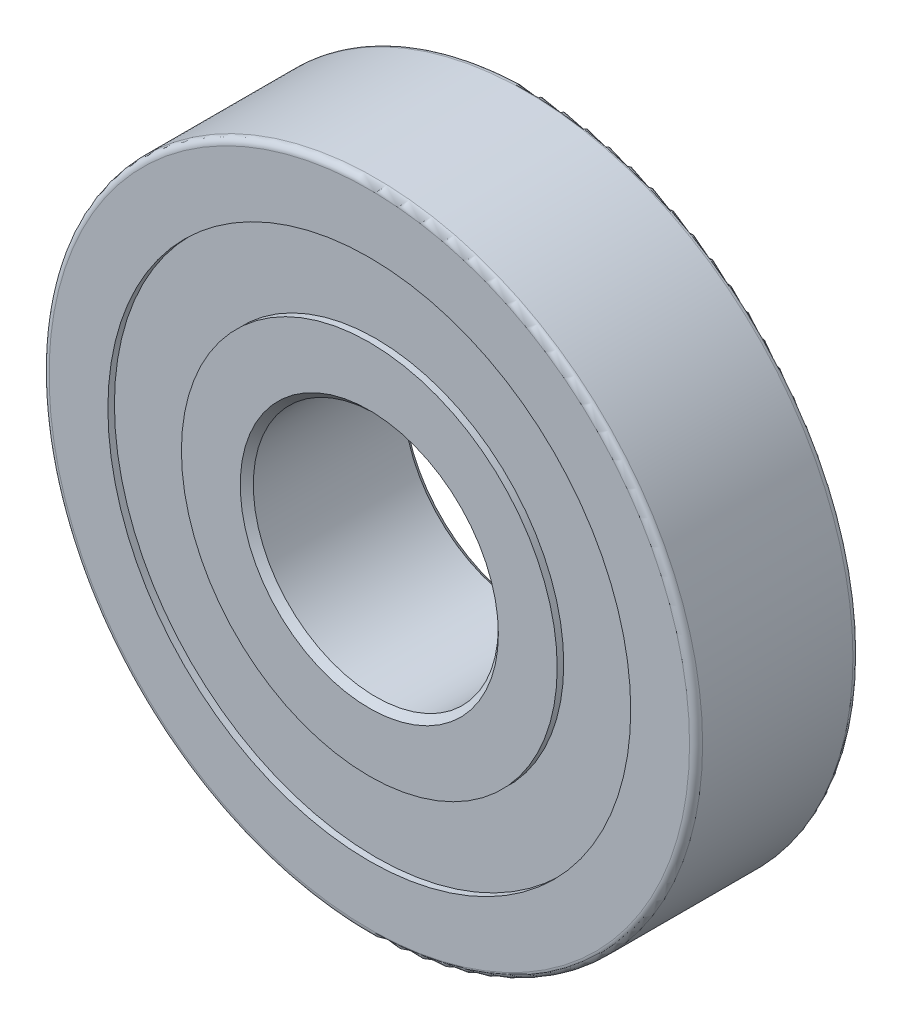
from build123d import *

# Parameters (mm, degrees)
SKETCH1_R             = 6.35
SKETCH1_R_2           = 5.08
BOSS_EXTRUDE1_DEPTH   = 1.5875
SKETCH1_R_3           = 3.65125
SKETCH1_R_4           = 2.38125
BOSS_EXTRUDE1_2_DEPTH = 1.5875
SKETCH2_R             = 5.08
SKETCH2_R_2           = 3.65125
BOSS_EXTRUDE2_DEPTH   = 1.4605
FILLET1_R             = 0.127
CHAMFER1_SIZE         = 0.127


with BuildPart() as part:
    # Sketch1 → Boss-Extrude1 (new, symmetric)
    with BuildSketch(Plane.XY):
        Circle(SKETCH1_R)
        Circle(SKETCH1_R_2, mode=Mode.SUBTRACT)
    extrude(amount=BOSS_EXTRUDE1_DEPTH, both=True)



with BuildPart() as body_2:
    # Sketch1 → Boss-Extrude1 2 (new, symmetric)
    with BuildSketch(Plane.XY):
        Circle(SKETCH1_R_3)
        Circle(SKETCH1_R_4, mode=Mode.SUBTRACT)
    extrude(amount=BOSS_EXTRUDE1_2_DEPTH, both=True)


with BuildPart() as part_1:
    add(part.part)

    add(body_2.part)  # Boss-Extrude2 merges body 2
    # Sketch2 → Boss-Extrude2 (add, symmetric)
    with BuildSketch(Plane.XY):
        Circle(SKETCH2_R)
        Circle(SKETCH2_R_2, mode=Mode.SUBTRACT)
    extrude(amount=BOSS_EXTRUDE2_DEPTH, both=True)

    # Fillet1
    fillet1_edges = [part_1.edges().sort_by_distance(p)[0] for p in [
        (-6.35, 0, 1.5875),
        (-6.35, 0, -1.5875),
    ]]
    fillet(fillet1_edges, radius=FILLET1_R)

    # Chamfer1
    chamfer1_edges = [part_1.edges().sort_by_distance(p)[0] for p in [
        (-2.38125, 0, 1.5875),
        (-2.38125, 0, -1.5875),
    ]]
    chamfer(chamfer1_edges, length=CHAMFER1_SIZE)


solid = part_1.part
